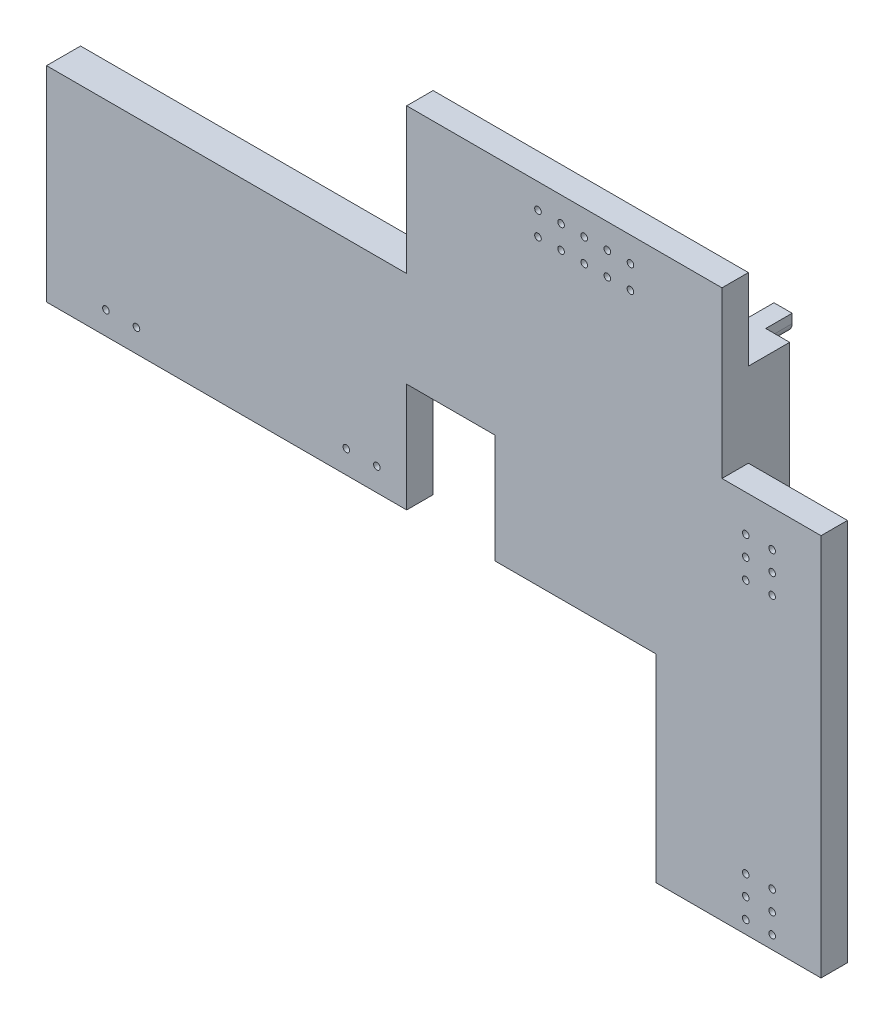
from build123d import *

# Parameters (mm, degrees)
SKETCH_2_W                       = 102.2634
SKETCH_2_H                       = 83
EXTRUDE_1_DEPTH                  = 4
SKETCH_4_W                       = 54.5268
SKETCH_4_H                       = 6
EXTRUDE_2_DEPTH                  = 1.15
SKETCH_5_W                       = 47.7366
SKETCH_5_H                       = 25.46
EXTRUDE_3_DEPTH                  = 6.25
SKETCH_6_R                       = 1.375
EXTRUDE_4_DEPTH                  = 4
SKETCH_7_W                       = 13.3866
SKETCH_7_H                       = 1.23
CUT_EXTRUDE_1_DEPTH              = 89.062832682
SKETCH_8_W                       = 13.3866
SKETCH_8_H                       = 16.5
CUT_EXTRUDE_3_DEPTH              = 89.062832682
SKETCH_9_W                       = 15
SKETCH_9_H                       = 83
EXTRUDE_5_DEPTH                  = 4
SKETCH_10_R                      = 0.5
CUT_EXTRUDE_4_DEPTH              = 102.143771435
PATTERN_LINEAR_1_COUNT           = 3
PATTERN_LINEAR_1_PITCH           = 3
PATTERN_LINEAR_2_COUNT           = 2
PATTERN_LINEAR_2_PITCH           = 44.5
PATTERN_LINEAR_2_COPY_1_SKETCH_R = 0.5
PATTERN_LINEAR_2_COPY_1_DEPTH    = 102.143771435
PATTERN_LINEAR_2_COPY_2_SKETCH_R = 0.5
PATTERN_LINEAR_2_COPY_2_DEPTH    = 102.143771435
SKETCH_12_R                      = 0.5
CUT_EXTRUDE_5_DEPTH              = 102.143771435
PATTERN_LINEAR_3_COUNT           = 5
PATTERN_LINEAR_3_PITCH           = 3.5
SKETCH_13_R                      = 0.5
CUT_EXTRUDE_6_DEPTH              = 102.143771435
SKETCH_14_W                      = 92.2634
SKETCH_14_H                      = 30
SKETCH_14_W_2                    = 15
SKETCH_14_H_2                    = 25
SKETCH_14_W_3                    = 54.5268
SKETCH_14_H_3                    = 22
CUT_EXTRUDE_7_DEPTH              = 102.143771435


with BuildPart() as part:
    # 草图2 → 凸台-拉伸1 (new body)
    with BuildSketch(Plane.XY):
        with Locations((23.8683, 3.5)):
            Rectangle(SKETCH_2_W, SKETCH_2_H)
    extrude(amount=EXTRUDE_1_DEPTH)

    # 草图4 → 凸台-拉伸2 (add)
    with BuildSketch(Plane(origin=(0, 0, 0), x_dir=(-1, 0, 0), z_dir=(0, 0, -1))):
        with Locations((0, 20)):
            Rectangle(SKETCH_4_W, SKETCH_4_H)
    extrude(amount=EXTRUDE_2_DEPTH)

    # 草图5 → 凸台-拉伸3 (add)
    with BuildSketch(Plane(origin=(0, 0, 0), x_dir=(-1, 0, 0), z_dir=(0, 0, -1))):
        with Locations((-51.1317, 20)):
            Rectangle(SKETCH_5_W, SKETCH_5_H)
    extrude(amount=EXTRUDE_3_DEPTH)

    # 草图6 → 凸台-拉伸4 (add)
    with BuildSketch(Plane(origin=(0, 0, -6.25), x_dir=(-1, 0, 0), z_dir=(0, 0, -1))):
        with Locations((-70, 31.355)):
            Circle(SKETCH_6_R)
        with Locations((-70, 8.645)):
            Circle(SKETCH_6_R)
        with Locations((-43.15, 8.645)):
            Circle(SKETCH_6_R)
        with Locations((-32.2634, 31.355)):
            Circle(SKETCH_6_R)
        with BuildLine():
            Line((-70, 32.73), (-71.375, 32.73))
            Line((-71.375, 32.73), (-71.375, 31.355))
            ThreePointArc((-71.375, 31.355), (-70.972271824, 32.327271824), (-70, 32.73))
        make_face()
        with BuildLine():
            Line((-68.625, 32.73), (-70, 32.73))
            ThreePointArc((-70, 32.73), (-69.027728176, 32.327271824), (-68.625, 31.355))
            Line((-68.625, 31.355), (-68.625, 32.73))
        make_face()
        with BuildLine():
            Line((-30.8884, 31.355), (-30.8884, 32.73))
            Line((-30.8884, 32.73), (-32.2634, 32.73))
            ThreePointArc((-32.2634, 32.73), (-31.291128176, 32.327271824), (-30.8884, 31.355))
        make_face()
        with BuildLine():
            Line((-32.2634, 32.73), (-33.6384, 32.73))
            Line((-33.6384, 32.73), (-33.6384, 31.355))
            ThreePointArc((-33.6384, 31.355), (-33.235671824, 32.327271824), (-32.2634, 32.73))
        make_face()
        with BuildLine():
            ThreePointArc((-70, 7.27), (-70.972271824, 7.672728176), (-71.375, 8.645))
            Line((-71.375, 8.645), (-71.375, 7.27))
            Line((-71.375, 7.27), (-70, 7.27))
        make_face()
        with BuildLine():
            Line((-68.625, 7.27), (-68.625, 8.645))
            ThreePointArc((-68.625, 8.645), (-69.027728176, 7.672728176), (-70, 7.27))
            Line((-70, 7.27), (-68.625, 7.27))
        make_face()
        with BuildLine():
            ThreePointArc((-41.775, 8.645), (-42.177728176, 7.672728176), (-43.15, 7.27))
            Line((-43.15, 7.27), (-41.775, 7.27))
            Line((-41.775, 7.27), (-41.775, 8.645))
        make_face()
        with BuildLine():
            Line((-44.525, 8.645), (-44.525, 7.27))
            Line((-44.525, 7.27), (-43.15, 7.27))
            ThreePointArc((-43.15, 7.27), (-44.122271824, 7.672728176), (-44.525, 8.645))
        make_face()
    extrude(amount=EXTRUDE_4_DEPTH)

    # 草图7 → 切除-拉伸1 (cut, through all)
    with BuildSketch(Plane(origin=(0, 0, -6.25), x_dir=(-1, 0, 0), z_dir=(0, 0, -1))):
        with Locations((-33.9567, 7.885)):
            Rectangle(SKETCH_7_W, SKETCH_7_H)
    extrude(amount=-CUT_EXTRUDE_1_DEPTH, mode=Mode.SUBTRACT)

    # 草图8 → 切除-拉伸3 (cut, through all)
    with BuildSketch(Plane(origin=(0, 0, 0), x_dir=(-1, 0, 0), z_dir=(0, 0, -1))):
        with Locations((-33.9567, 0.25)):
            Rectangle(SKETCH_8_W, SKETCH_8_H)
    extrude(amount=-CUT_EXTRUDE_3_DEPTH, mode=Mode.SUBTRACT)

    # 草图9 → 凸台-拉伸5 (add)
    with BuildSketch(Plane.XY):
        with Locations((82.5, 3.5)):
            Rectangle(SKETCH_9_W, SKETCH_9_H)
    extrude(amount=EXTRUDE_5_DEPTH)

    # 草图10 → 切除-拉伸4 (cut, through all)
    with BuildSketch(Plane(origin=(0, 0, 0), x_dir=(-1, 0, 0), z_dir=(0, 0, -1))):
        with Locations((-78.6, 8.47)):
            Circle(SKETCH_10_R)
        with Locations((-82.6, 8.47)):
            Circle(SKETCH_10_R)
    cut_extrude_4 = extrude(amount=-CUT_EXTRUDE_4_DEPTH, mode=Mode.SUBTRACT)

    # 阵列(线性)1: 切除-拉伸4 ×3
    with Locations(*[(0, i * PATTERN_LINEAR_1_PITCH, 0) for i in range(1, PATTERN_LINEAR_1_COUNT)]):
        add(cut_extrude_4, mode=Mode.SUBTRACT)

    # 阵列(线性)2: 切除-拉伸4 ×2
    with Locations(*[(0, -i * PATTERN_LINEAR_2_PITCH, 0) for i in range(1, PATTERN_LINEAR_2_COUNT)]):
        add(cut_extrude_4, mode=Mode.SUBTRACT)

    # 阵列(线性)2 copy 1 sketch → 阵列(线性)2 copy 1 (cut, through all)
    with BuildSketch(Plane(origin=(0, -41.5, 0), x_dir=(-1, 0, 0), z_dir=(0, 0, -1))):
        with Locations((-78.6, 8.47)):
            Circle(PATTERN_LINEAR_2_COPY_1_SKETCH_R)
        with Locations((-82.6, 8.47)):
            Circle(PATTERN_LINEAR_2_COPY_1_SKETCH_R)
    extrude(amount=-PATTERN_LINEAR_2_COPY_1_DEPTH, mode=Mode.SUBTRACT)

    # 阵列(线性)2 copy 2 sketch → 阵列(线性)2 copy 2 (cut, through all)
    with BuildSketch(Plane(origin=(0, -38.5, 0), x_dir=(-1, 0, 0), z_dir=(0, 0, -1))):
        with Locations((-78.6, 8.47)):
            Circle(PATTERN_LINEAR_2_COPY_2_SKETCH_R)
        with Locations((-82.6, 8.47)):
            Circle(PATTERN_LINEAR_2_COPY_2_SKETCH_R)
    extrude(amount=-PATTERN_LINEAR_2_COPY_2_DEPTH, mode=Mode.SUBTRACT)

    # 草图12 → 切除-拉伸5 (cut, through all)
    with BuildSketch(Plane(origin=(0, 0, 0), x_dir=(-1, 0, 0), z_dir=(0, 0, -1))):
        with Locations((-61.143527556, 41.241100687)):
            Circle(SKETCH_12_R)
        with Locations((-61.143527556, 37.741100687)):
            Circle(SKETCH_12_R)
    cut_extrude_5 = extrude(amount=-CUT_EXTRUDE_5_DEPTH, mode=Mode.SUBTRACT)

    # 阵列(线性)3: 切除-拉伸5 ×5
    with Locations(*[(-i * PATTERN_LINEAR_3_PITCH, 0, 0) for i in range(1, PATTERN_LINEAR_3_COUNT)]):
        add(cut_extrude_5, mode=Mode.SUBTRACT)

    # 草图13 → 切除-拉伸6 (cut, through all)
    with BuildSketch(Plane(origin=(0, 0, 0), x_dir=(-1, 0, 0), z_dir=(0, 0, -1))):
        with Locations((-22.75, -4.52)):
            Circle(SKETCH_13_R)
        with Locations((-18.125, -4.52)):
            Circle(SKETCH_13_R)
        with Locations((13.65, -4.52)):
            Circle(SKETCH_13_R)
        with Locations((18.27, -4.52)):
            Circle(SKETCH_13_R)
    extrude(amount=-CUT_EXTRUDE_6_DEPTH, mode=Mode.SUBTRACT)

    # 草图14 → 切除-拉伸7 (cut, through all)
    with BuildSketch(Plane(origin=(0, 0, 0), x_dir=(-1, 0, 0), z_dir=(0, 0, -1))):
        with Locations((-18.8683, -23)):
            Rectangle(SKETCH_14_W, SKETCH_14_H)
        with Locations((-82.5, 32.5)):
            Rectangle(SKETCH_14_W_2, SKETCH_14_H_2)
        with Locations((0, 34)):
            Rectangle(SKETCH_14_W_3, SKETCH_14_H_3)
    extrude(amount=-CUT_EXTRUDE_7_DEPTH, mode=Mode.SUBTRACT)


solid = part.part
